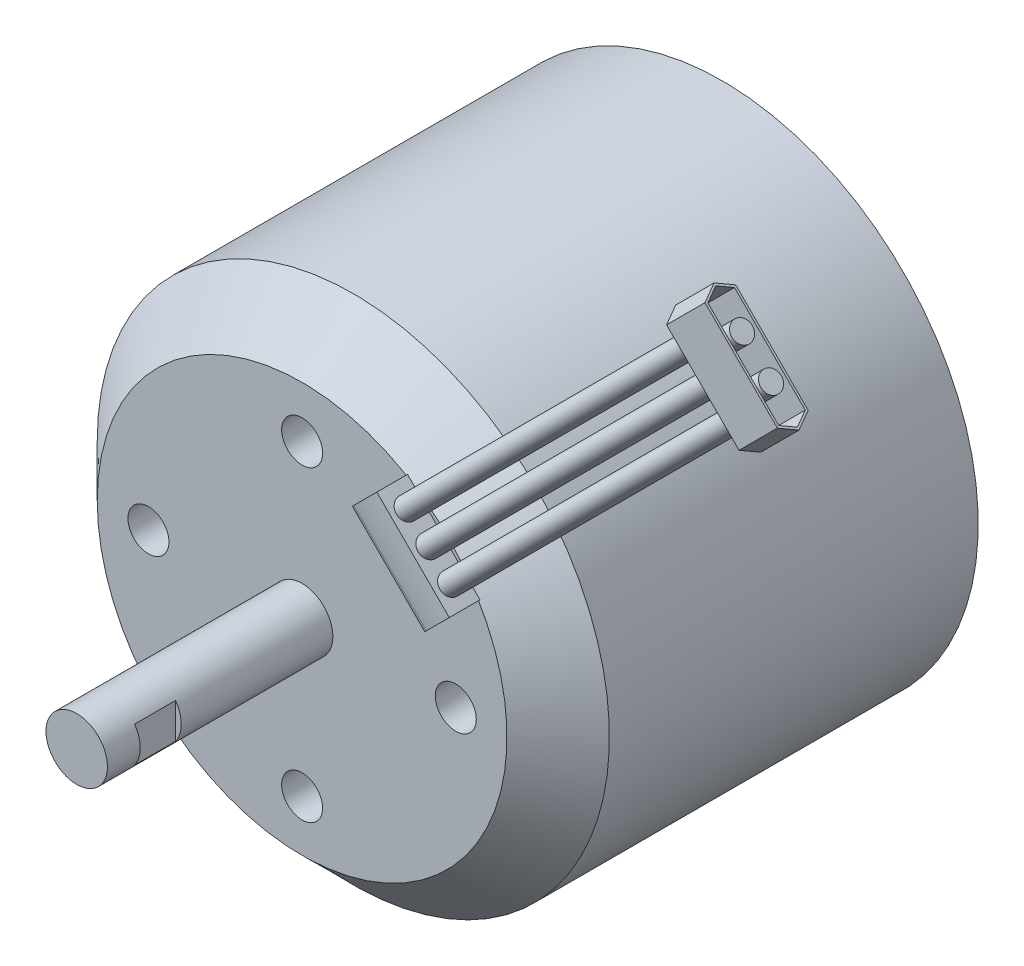
from build123d import *

# Parameters (mm, degrees)
HOLE_WIZARD_M4_1_D     = 4
HOLE_WIZARD_M4_1_DEPTH = 6.1
HOLE_WIZARD_M4_1_TIP   = 1.201721238
HOLE_WIZARD_M3_1_D     = 3
HOLE_WIZARD_M3_1_DEPTH = 5.5
HOLE_WIZARD_M3_1_TIP   = 0.901290929
SKETCH_11_R            = 1
EXTRUDE_1_DEPTH        = 40
EXTRUDE_2_DEPTH        = 0.3
SKETCH_13_R            = 1
EXTRUDE_3_DEPTH        = 5
CUT_EXTRUDE_1_DEPTH    = 4
CUT_EXTRUDE_2_DEPTH    = 10


with BuildPart() as part:
    # 草图1 → 旋转1 (revolve)
    with BuildSketch(Plane(origin=(0, 0, 0), x_dir=(0, 0, -1), z_dir=(1, 0, 0)), mode=Mode.PRIVATE) as revolve_1_sk:
        Polygon((-2, 25), (-38, 25), (-43, 20), (-43, 3), (-65, 3), (-65, 0), (0, 0), (0, 3), (-2, 3), align=None)
    revolve(revolve_1_sk.sketch.rotate(Axis((0, 0, 0), (0, 0, 1)), 90), axis=Axis((0, 0, 0), (0, 0, 1)))

    # M4 螺纹孔1
    with Locations(Plane.XY.offset(43)):
        with Locations((0, 15), (15, 0), (0, -15), (-15, 0)):
            Hole(HOLE_WIZARD_M4_1_D / 2, depth=HOLE_WIZARD_M4_1_DEPTH)
            with Locations((0, 0, -(HOLE_WIZARD_M4_1_DEPTH + HOLE_WIZARD_M4_1_TIP / 2))):  # 118° drill point
                Cone(0, HOLE_WIZARD_M4_1_D / 2, HOLE_WIZARD_M4_1_TIP, mode=Mode.SUBTRACT)

    # M3 螺纹孔1
    with Locations(Plane(origin=(0, 0, 2), x_dir=(-1, 0, 0), z_dir=(0, 0, -1))):
        with Locations((0, 10), (10, 0), (0, -10), (-10, 0)):
            Hole(HOLE_WIZARD_M3_1_D / 2, depth=HOLE_WIZARD_M3_1_DEPTH)
            with Locations((0, 0, -(HOLE_WIZARD_M3_1_DEPTH + HOLE_WIZARD_M3_1_TIP / 2))):  # 118° drill point
                Cone(0, HOLE_WIZARD_M3_1_D / 2, HOLE_WIZARD_M3_1_TIP, mode=Mode.SUBTRACT)

    # 扫描1: sweep along a path in 草图9
    with BuildLine(Plane(origin=(0, 0, 0), x_dir=(0.7071067811865477, 0.7071067811865475, 0), z_dir=(-0.7071067811865475, 0.7071067811865477, 0))) as sweep_1_path:
        ThreePointArc((16, -43), (16.361695911, -44.147152873), (17.315959713, -44.879385242))
        ThreePointArc((17.315959713, -44.879385242), (19.138240785, -45.367663983), (21.017626027, -45.532088886))
    # 草图8 → 扫描1 (sweep)
    with BuildSketch(Plane.XY.offset(43)):
        Polygon((6.717514421, 13.788582233), (13.788582233, 6.717514421), (15.909902577, 8.838834765), (8.838834765, 15.909902577), align=None)
    sweep(path=sweep_1_path.line)

    # 草图11 → 凸台-拉伸1 (add)
    with BuildSketch(Plane(origin=(14.861705888, 14.861705888, 0), x_dir=(0, 0, -1), z_dir=(0.7071067811865476, 0.7071067811865476, 0))):
        with Locations(Location((-45.532088886, 0, 0), (0, 0, 270))):
            Circle(SKETCH_11_R)
        with Locations(Location((-45.532088886, 3, 0), (0, 0, 270))):
            Circle(SKETCH_11_R)
        with Locations(Location((-45.532088886, -3, 0), (0, 0, 270))):
            Circle(SKETCH_11_R)
    extrude(amount=EXTRUDE_1_DEPTH)

    # 草图12 → 凸台-拉伸2 (add)
    with BuildSketch(Plane(origin=(43.145977136, 43.145977136, 0), x_dir=(0, 0, -1), z_dir=(0.7071067811865477, 0.7071067811865475, 0))):
        Polygon((-47.032088886, -5), (-45.532088886, -5.866025404), (-44.032088886, -5), (-44.032088886, 5), (-45.532088886, 5.866025404), (-47.032088886, 5), align=None)
    extrude(amount=EXTRUDE_2_DEPTH)

    # 草图13 → 凸台-拉伸3 (add)
    # profile 1 of 3: a face of its own
    with BuildSketch(Plane(origin=(43.35810917, 43.35810917, 0), x_dir=(0, 0, -1), z_dir=(0.7071067811865477, 0.7071067811865475, -3.269036566852065e-15))):
        Polygon((-47.032088886, 5), (-47.032088886, -5), (-45.532088886, -5.866025404), (-44.032088886, -5), (-44.032088886, 5), (-45.532088886, 5.866025404), align=None)
        Polygon((-46.832088886, 4.884529946), (-46.832088886, -4.884529946), (-45.532088886, -5.635085296), (-44.232088886, -4.884529946), (-44.232088886, 4.884529946), (-45.532088886, 5.635085296), align=None, mode=Mode.SUBTRACT)
    # profile 2 of 3: a face of its own
    with BuildSketch(Plane(origin=(43.35810917, 43.35810917, 0), x_dir=(0, 0, -1), z_dir=(0.7071067811865477, 0.7071067811865475, -3.269036566852065e-15))):
        with Locations(Location((-45.532088886, 2, 0), (0, 0, 90))):
            Circle(SKETCH_13_R)
    # profile 3 of 3: a face of its own
    with BuildSketch(Plane(origin=(43.35810917, 43.35810917, 0), x_dir=(0, 0, -1), z_dir=(0.7071067811865477, 0.7071067811865475, -3.269036566852065e-15))):
        with Locations(Location((-45.532088886, -2, 0), (0, 0, 90))):
            Circle(SKETCH_13_R)
    extrude(amount=EXTRUDE_3_DEPTH)

    # 草图14 → 切除-拉伸1 (cut)
    with BuildSketch(Plane.XY.offset(61.8)):
        with BuildLine():
            Line((-2.45, 1.731328969), (-2.45, -1.731328969))
            ThreePointArc((-2.45, -1.731328969), (-3, 0), (-2.45, 1.731328969))
        make_face()
        with BuildLine():
            Line((2.45, 1.731328969), (2.45, -1.731328969))
            ThreePointArc((2.45, -1.731328969), (3, 0), (2.45, 1.731328969))
        make_face()
    extrude(amount=-CUT_EXTRUDE_1_DEPTH, mode=Mode.SUBTRACT)

    # 草图15 → 切除-拉伸2 (cut)
    with BuildSketch(Plane.XY.offset(53)):
        with BuildLine():
            Line((-2.45, -1.731328969), (-2.45, 1.731328969))
            ThreePointArc((-2.45, 1.731328969), (-3, 0), (-2.45, -1.731328969))
        make_face()
    extrude(amount=-CUT_EXTRUDE_2_DEPTH, mode=Mode.SUBTRACT)


solid = part.part
